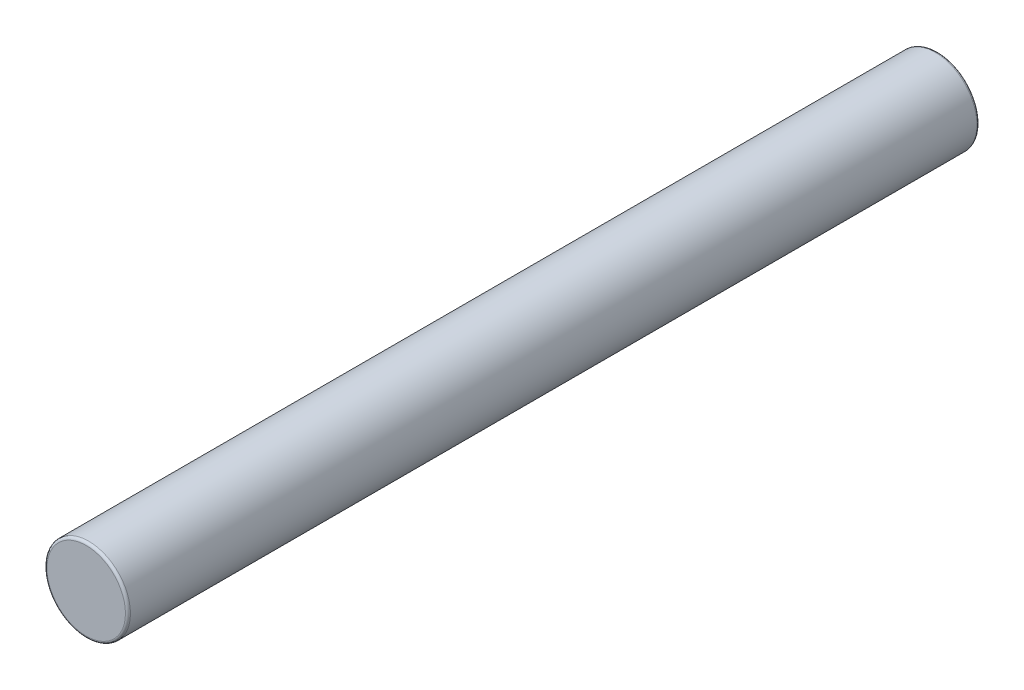
from build123d import *

# Parameters (mm, degrees)
SZKIC1_R                    = 5
DODANIE_WYCI_GNI_CIE1_DEPTH = 51
ZAOKR_GLENIE1_R             = 0.3


with BuildPart() as part:
    # Szkic1 → Dodanie-wyciągnięcie1 (new, symmetric)
    with BuildSketch(Plane.XY):
        Circle(SZKIC1_R)
    extrude(amount=DODANIE_WYCI_GNI_CIE1_DEPTH, both=True)

    # Zaokrąglenie1
    zaokr_glenie1_edges = [part.edges().sort_by_distance(p)[0] for p in [
        (-5, 0, -51),
        (-5, 0, 51),
    ]]
    fillet(zaokr_glenie1_edges, radius=ZAOKR_GLENIE1_R)


solid = part.part
